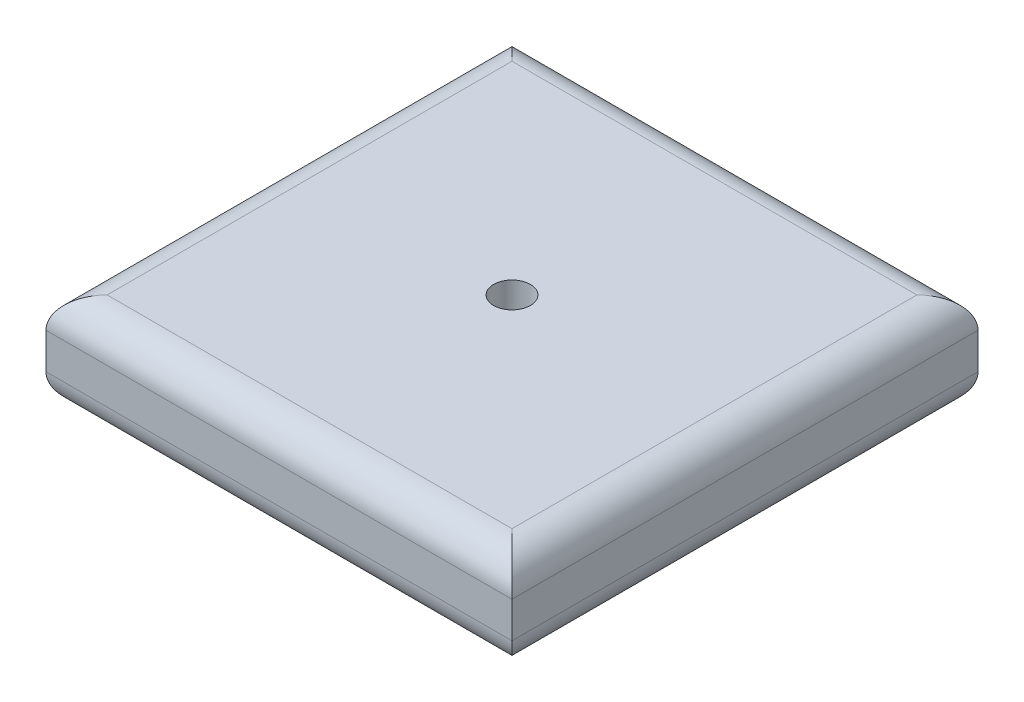
from build123d import *

# Parameters (mm, degrees)
SKETCH1_W           = 152.4
SKETCH1_H           = 152.4
BOSS_EXTRUDE1_DEPTH = 31.75
SKETCH2_R           = 6
CUT_EXTRUDE1_DEPTH  = 15
FILLET1_R           = 10
FILLET2_R           = 10


with BuildPart() as part:
    # Sketch1 → Boss-Extrude1 (new body)
    with BuildSketch(Plane(origin=(0, 0, 0), x_dir=(1, 0, 0), z_dir=(0, 1, 0))):
        with Locations((42.446979866, 76.2)):
            Rectangle(SKETCH1_W, SKETCH1_H)
    extrude(amount=BOSS_EXTRUDE1_DEPTH)

    # Sketch2 → Cut-Extrude1 (cut)
    with BuildSketch(Plane(origin=(0, 31.75, 0), x_dir=(1, 0, 0), z_dir=(0, 1, 0))):
        with Locations(Location((42.446979866, 76.2, 0), (0, 0, 270))):
            Circle(SKETCH2_R)
    extrude(amount=-CUT_EXTRUDE1_DEPTH, mode=Mode.SUBTRACT)

    # Fillet1
    fillet1_edges = [part.edges().sort_by_distance(p)[0] for p in [
        (118.646979866, 31.75, -76.2),
        (42.446979866, 31.75, -152.4),
        (-33.753020134, 31.75, -76.2),
        (42.446979866, 31.75, 0),
    ]]
    fillet(fillet1_edges, radius=FILLET1_R)

    # Fillet2
    fillet2_edges = [part.edges().sort_by_distance(p)[0] for p in [
        (42.446979866, 0, -152.4),
        (118.646979866, 0, -76.2),
        (42.446979866, 0, 0),
        (-33.753020134, 0, -76.2),
    ]]
    fillet(fillet2_edges, radius=FILLET2_R)


solid = part.part
